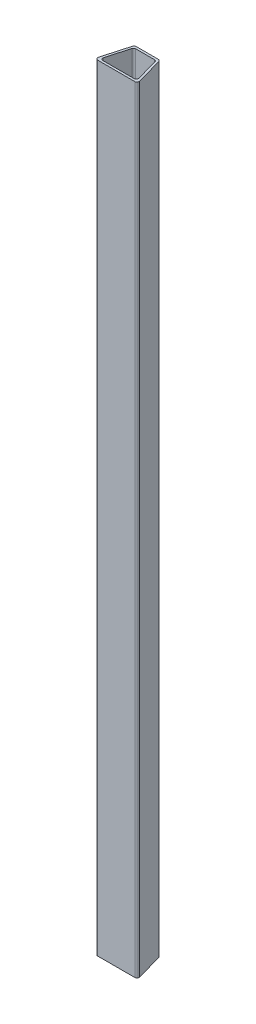
from build123d import *

# Parameters (mm, degrees)
BOSS_EXTRUDE1_DEPTH = 350


with BuildPart() as part:
    # Sketch1 → Boss-Extrude1 (new body)
    with BuildSketch(Plane(origin=(0, 0, 0), x_dir=(1, 0, 0), z_dir=(0, 1, 0))):
        with BuildLine():
            Line((-8.359903733, -7), (8.359903733, -7))
            ThreePointArc((8.359903733, -7), (9.157006479, -6.603843698), (9.322554673, -5.729254423))
            Line((9.322554673, -5.729254423), (5.947554673, 6.270745577))
            ThreePointArc((5.947554673, 6.270745577), (5.588747431, 6.797102746), (4.984903733, 7))
            Line((4.984903733, 7), (-4.984903733, 7))
            ThreePointArc((-4.984903733, 7), (-5.588747431, 6.797102746), (-5.947554673, 6.270745577))
            Line((-5.947554673, 6.270745577), (-9.322554673, -5.729254423))
            ThreePointArc((-9.322554673, -5.729254423), (-9.157006479, -6.603843698), (-8.359903733, -7))
        make_face()
        with BuildLine():
            Line((-7.039855599, -6), (7.039855599, -6))
            ThreePointArc((7.039855599, -6), (7.836958346, -5.603843698), (8.002506539, -4.729254423))
            Line((8.002506539, -4.729254423), (5.190006539, 5.270745577))
            ThreePointArc((5.190006539, 5.270745577), (4.831199297, 5.797102746), (4.227355599, 6))
            Line((4.227355599, 6), (-4.227355599, 6))
            ThreePointArc((-4.227355599, 6), (-4.831199297, 5.797102746), (-5.190006539, 5.270745577))
            Line((-5.190006539, 5.270745577), (-8.002506539, -4.729254423))
            ThreePointArc((-8.002506539, -4.729254423), (-7.836958346, -5.603843698), (-7.039855599, -6))
        make_face(mode=Mode.SUBTRACT)
    extrude(amount=BOSS_EXTRUDE1_DEPTH)


solid = part.part
